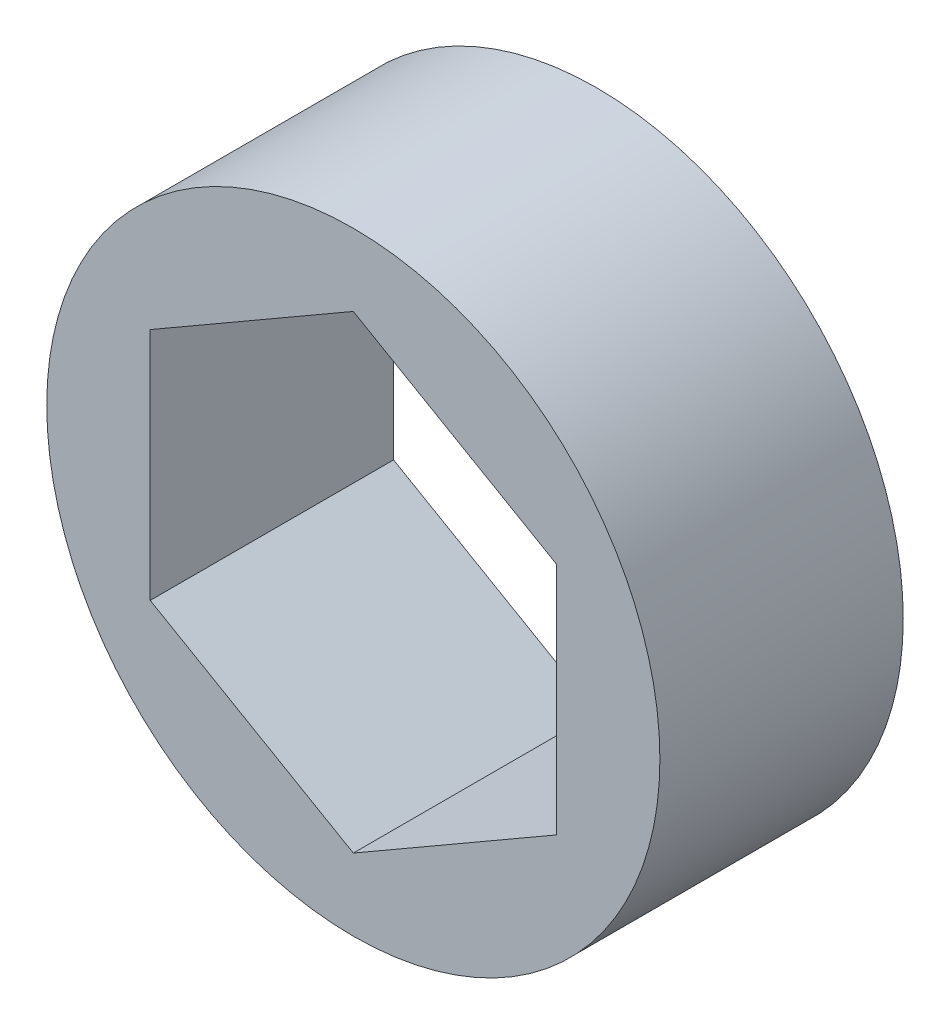
from build123d import *

# Parameters (mm, degrees)
SKETCH1_R           = 10.16
BOSS_EXTRUDE1_DEPTH = 8.0645


with BuildPart() as part:
    # Sketch1 → Boss-Extrude1 (new body)
    with BuildSketch(Plane.XY):
        Circle(SKETCH1_R)
        Polygon((6.731, 3.886144662), (0, 7.772289324), (-6.731, 3.886144662), (-6.731, -3.886144662), (0, -7.772289324), (6.731, -3.886144662), align=None, mode=Mode.SUBTRACT)
    extrude(amount=BOSS_EXTRUDE1_DEPTH)


solid = part.part
